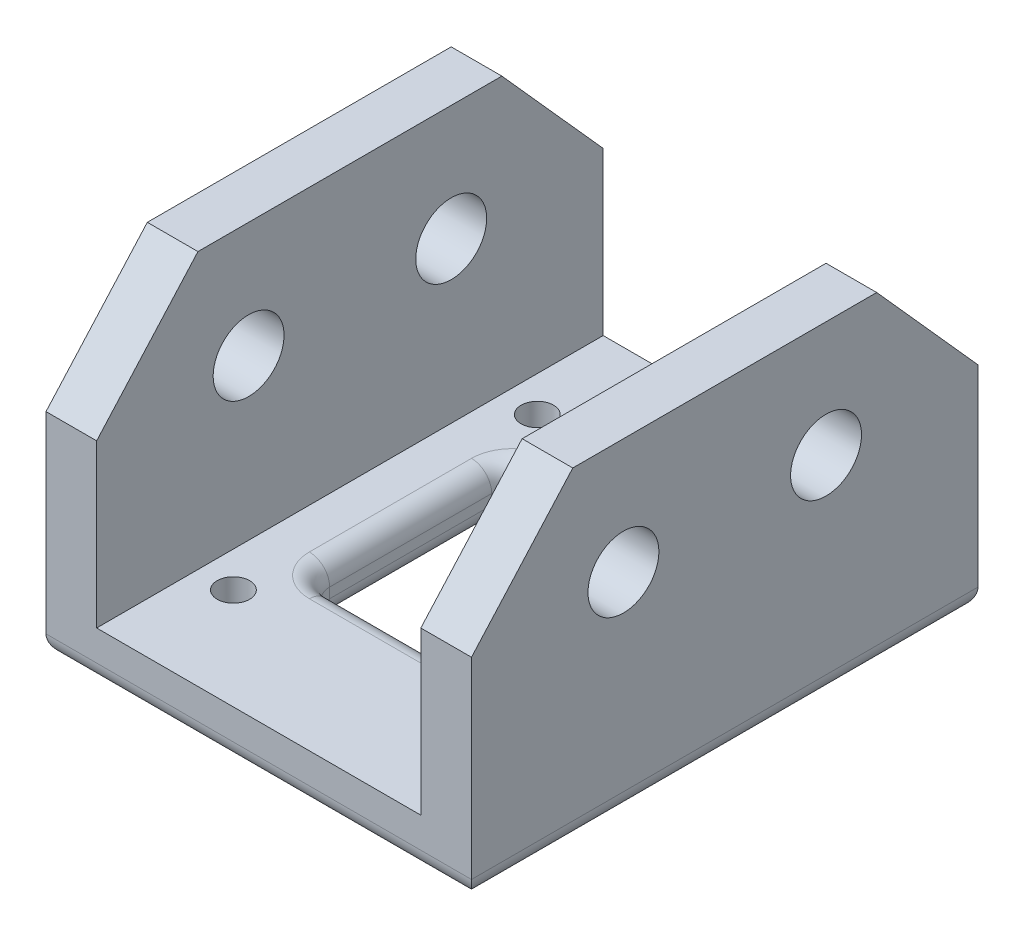
from build123d import *

# Parameters (mm, degrees)
SKETCH1_W           = 63.5
SKETCH1_H           = 6.35
BOSS_EXTRUDE1_DEPTH = 53.34
BOSS_EXTRUDE2_DEPTH = 6.35
CUT_EXTRUDE1_REACH  = 94.454
SKETCH11_R          = 4.445
FILLET1_R           = 2.54
CUT_EXTRUDE2_REACH  = 94.454
SKETCH19_R          = 2.032
CUT_EXTRUDE3_DEPTH  = 6.35
FILLET2_R           = 2.54


with BuildPart() as part:
    # Sketch1 → Boss-Extrude1 (new body)
    with BuildSketch(Plane(origin=(0, 0, 0), x_dir=(0, 0, -1), z_dir=(1, 0, 0))):
        with Locations((31.75, 3.175)):
            Rectangle(SKETCH1_W, SKETCH1_H)
    extrude(amount=-BOSS_EXTRUDE1_DEPTH)

    # Sketch2 → Boss-Extrude2 (add)
    with BuildSketch(Plane(origin=(0, 0, 0), x_dir=(0, 0, -1), z_dir=(1, 0, 0))):
        Polygon((0, 6.35), (0, 26.67), (12.7, 40.869031657), (50.8, 40.869031657), (63.5, 26.67), (63.5, 6.35), align=None)
    boss_extrude2 = extrude(amount=-BOSS_EXTRUDE2_DEPTH)

    # Sketch11 → Cut-Extrude1 (cut, up to next)
    with BuildSketch(Plane(origin=(0, 0, 0), x_dir=(0, 0, -1), z_dir=(1, 0, 0)), mode=Mode.PRIVATE) as cut_extrude1_sk1:
        with Locations((19.05, 26.391031657)):
            Circle(SKETCH11_R)
    cut_extrude1_tool1 = extrude(cut_extrude1_sk1.sketch, amount=-CUT_EXTRUDE1_REACH, mode=Mode.PRIVATE) & part.part
    # Sketch11 → Cut-Extrude1 (cut, up to next)
    with BuildSketch(Plane(origin=(0, 0, 0), x_dir=(0, 0, -1), z_dir=(1, 0, 0)), mode=Mode.PRIVATE) as cut_extrude1_sk2:
        with Locations((44.45, 26.391031657)):
            Circle(SKETCH11_R)
    cut_extrude1_tool2 = extrude(cut_extrude1_sk2.sketch, amount=-CUT_EXTRUDE1_REACH, mode=Mode.PRIVATE) & part.part
    cut_extrude1_1 = cut_extrude1_tool1.solids().sort_by_distance((0, 26.391032, -19.05))[0]
    add(cut_extrude1_1, mode=Mode.SUBTRACT)
    cut_extrude1_2 = cut_extrude1_tool2.solids().sort_by_distance((0, 26.391032, -44.45))[0]
    add(cut_extrude1_2, mode=Mode.SUBTRACT)
    cut_extrude1 = cut_extrude1_1 + cut_extrude1_2  # Cut-Extrude1 as one shape, for the pattern or mirror that repeats it

    # Fillet1
    fillet1_edges = [part.edges().sort_by_distance(p)[0] for p in [
        (0, 0, -31.75),
        (-53.34, 0, -31.75),
        (-26.67, 0, -63.5),
        (-26.67, 0, 0),
    ]]
    fillet(fillet1_edges, radius=FILLET1_R)

    # Sketch19 → Cut-Extrude2 (cut, up to next)
    with BuildSketch(Plane.XZ, mode=Mode.PRIVATE) as cut_extrude2_sk1:
        with Locations(Location((-10.795, -50.8, 0), (0, 0, 270))):
            Circle(SKETCH19_R)
    cut_extrude2_tool1 = extrude(cut_extrude2_sk1.sketch, amount=-CUT_EXTRUDE2_REACH, mode=Mode.PRIVATE) & part.part
    # Sketch19 → Cut-Extrude2 (cut, up to next)
    with BuildSketch(Plane.XZ, mode=Mode.PRIVATE) as cut_extrude2_sk2:
        with Locations(Location((-42.545, -50.8, 0), (0, 0, 270))):
            Circle(SKETCH19_R)
    cut_extrude2_tool2 = extrude(cut_extrude2_sk2.sketch, amount=-CUT_EXTRUDE2_REACH, mode=Mode.PRIVATE) & part.part
    # Sketch19 → Cut-Extrude2 (cut, up to next)
    with BuildSketch(Plane.XZ, mode=Mode.PRIVATE) as cut_extrude2_sk3:
        with Locations(Location((-42.545, -12.7, 0), (0, 0, 270))):
            Circle(SKETCH19_R)
    cut_extrude2_tool3 = extrude(cut_extrude2_sk3.sketch, amount=-CUT_EXTRUDE2_REACH, mode=Mode.PRIVATE) & part.part
    # Sketch19 → Cut-Extrude2 (cut, up to next)
    with BuildSketch(Plane.XZ, mode=Mode.PRIVATE) as cut_extrude2_sk4:
        with Locations(Location((-10.795, -12.7, 0), (0, 0, 270))):
            Circle(SKETCH19_R)
    cut_extrude2_tool4 = extrude(cut_extrude2_sk4.sketch, amount=-CUT_EXTRUDE2_REACH, mode=Mode.PRIVATE) & part.part
    add(cut_extrude2_tool1.solids().sort_by_distance((-10.795, 0, -50.8))[0], mode=Mode.SUBTRACT)
    add(cut_extrude2_tool2.solids().sort_by_distance((-42.545, 0, -50.8))[0], mode=Mode.SUBTRACT)
    add(cut_extrude2_tool3.solids().sort_by_distance((-42.545, 0, -12.7))[0], mode=Mode.SUBTRACT)
    add(cut_extrude2_tool4.solids().sort_by_distance((-10.795, 0, -12.7))[0], mode=Mode.SUBTRACT)

    # Mirror1: Boss-Extrude2, Cut-Extrude1 across plane
    add(boss_extrude2.mirror(Plane(origin=(-26.67, 0, 0), x_dir=(0, 0, 1), z_dir=(1, 0, 0))))
    add(cut_extrude1.mirror(Plane(origin=(-26.67, 0, 0), x_dir=(0, 0, 1), z_dir=(1, 0, 0))), mode=Mode.SUBTRACT)

    # Sketch20 → Cut-Extrude3 (cut)
    with BuildSketch(Plane.XZ):
        with BuildLine():
            Line((-16.51, -19.05), (-36.83, -19.05))
            ThreePointArc((-36.83, -19.05), (-38.626051224, -19.793948776), (-39.37, -21.59))
            Line((-39.37, -21.59), (-39.37, -41.91))
            ThreePointArc((-39.37, -41.91), (-38.626051224, -43.706051224), (-36.83, -44.45))
            Line((-36.83, -44.45), (-16.51, -44.45))
            ThreePointArc((-16.51, -44.45), (-14.713948776, -43.706051224), (-13.97, -41.91))
            Line((-13.97, -41.91), (-13.97, -21.59))
            ThreePointArc((-13.97, -21.59), (-14.713948776, -19.793948776), (-16.51, -19.05))
        make_face()
    extrude(amount=-CUT_EXTRUDE3_DEPTH, mode=Mode.SUBTRACT)

    # Fillet2
    fillet2_edges = [part.edges().sort_by_distance(p)[0] for p in [
        (-38.626051224, 0, -43.706051224),
        (-26.67, 0, -44.45),
        (-14.713948776, 0, -43.706051224),
        (-13.97, 0, -31.75),
        (-14.713948776, 0, -19.793948776),
        (-26.67, 0, -19.05),
        (-38.626051224, 0, -19.793948776),
        (-39.37, 0, -31.75),
        (-26.67, 6.35, -44.45),
        (-14.713948776, 6.35, -43.706051224),
        (-13.97, 6.35, -31.75),
        (-14.713948776, 6.35, -19.793948776),
        (-26.67, 6.35, -19.05),
        (-38.626051224, 6.35, -19.793948776),
        (-39.37, 6.35, -31.75),
        (-38.626051224, 6.35, -43.706051224),
    ]]
    fillet(fillet2_edges, radius=FILLET2_R)


solid = part.part
